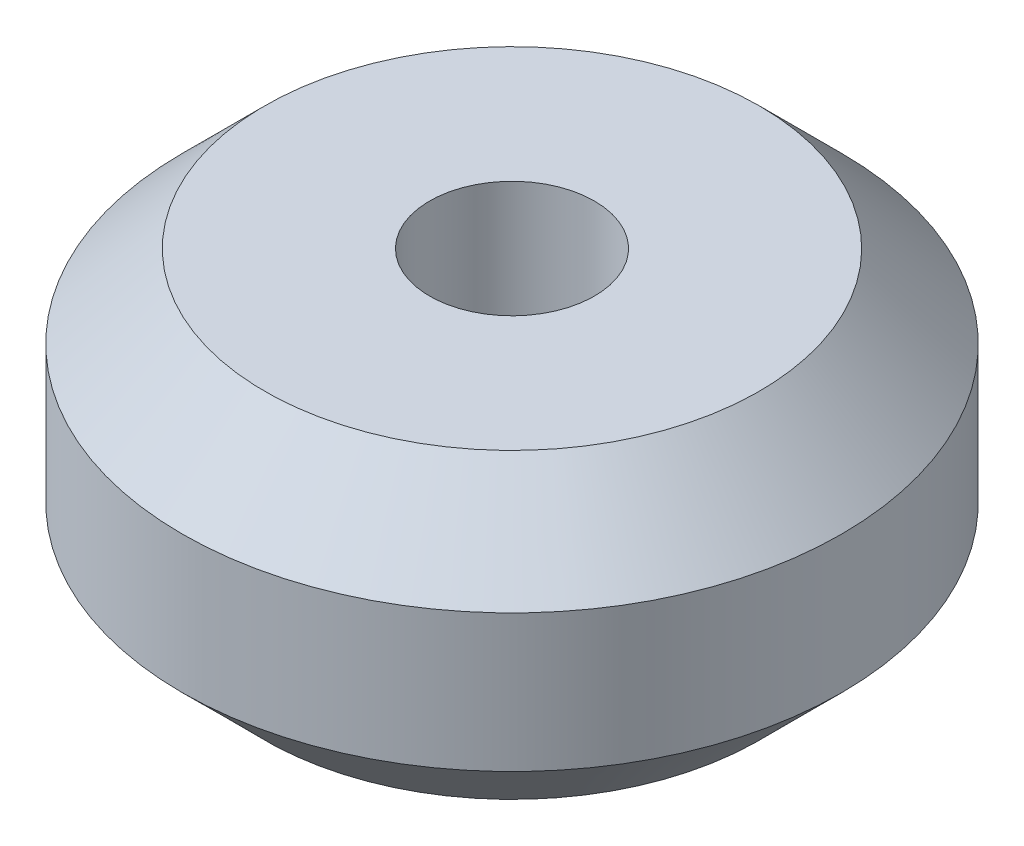
from build123d import *


with BuildPart() as part:
    # Эскиз1 → Повернуть1 (revolve)
    with BuildSketch(Plane(origin=(0, 0, 0), x_dir=(0, 0, -1), z_dir=(1, 0, 0))):
        Polygon((3, 5.5), (9, 5.5), (12, 2.5), (12, 0), (3, 0), align=None)
    revolve_1 = revolve(axis=Axis((0, 0, 0), (0, 1, 0)))

    # Зеркальное отражение1: Повернуть1 across plane
    add(revolve_1.mirror(Plane.ZX))


solid = part.part
